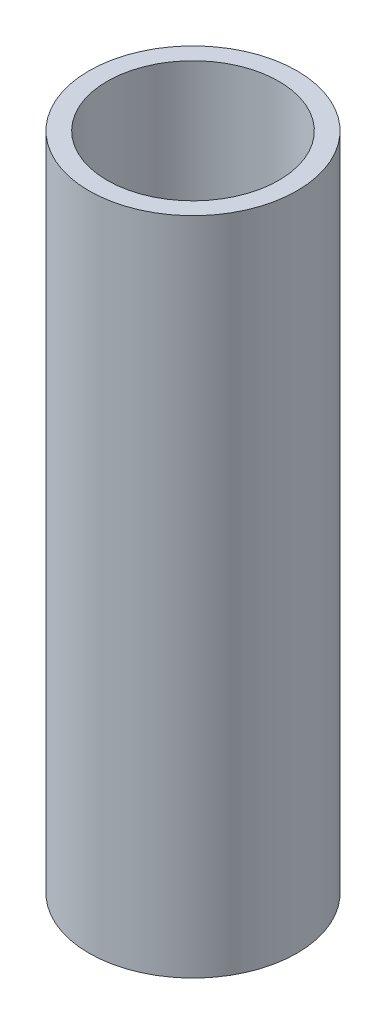
from build123d import *

# Parameters (mm, degrees)
SKETCH_1_R      = 12.6
EXTRUDE_1_DEPTH = 80
SHELL_1_T       = -2.2


with BuildPart() as part:
    # 스케치1 → 보스-돌출1 (new body)
    with BuildSketch(Plane(origin=(0, 0, 0), x_dir=(1, 0, 0), z_dir=(0, 1, 0))):
        with Locations(Location((0, 0, 0), (0, 0, 270))):
            Circle(SKETCH_1_R)
    extrude(amount=EXTRUDE_1_DEPTH)

    # 쉘1
    shell_1_openings = [part.faces().sort_by_distance(p)[0] for p in [
        (0, 80, 0),
        (0, 0, 0),
    ]]
    offset(amount=SHELL_1_T, openings=shell_1_openings, kind=Kind.INTERSECTION)


solid = part.part
